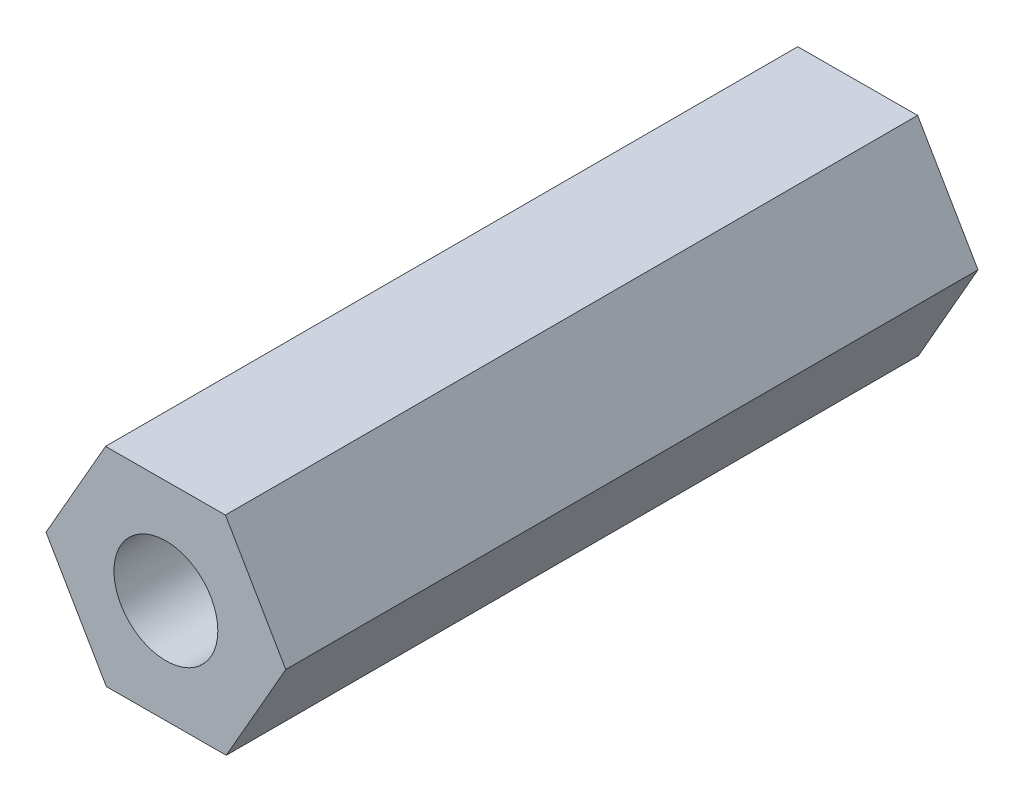
from build123d import *

# Parameters (mm, degrees)
SKETCH1_R           = 1.5
BOSS_EXTRUDE1_DEPTH = 20


with BuildPart() as part:
    # Sketch1 → Boss-Extrude1 (new body)
    with BuildSketch(Plane.XY):
        Polygon((1.720061114, 3.006890381), (-1.744012899, 2.993061811), (-3.464074013, -0.01382857), (-1.720061114, -3.006890381), (1.744012899, -2.993061811), (3.464074013, 0.01382857), align=None)
        Circle(SKETCH1_R, mode=Mode.SUBTRACT)
    extrude(amount=BOSS_EXTRUDE1_DEPTH)


solid = part.part
